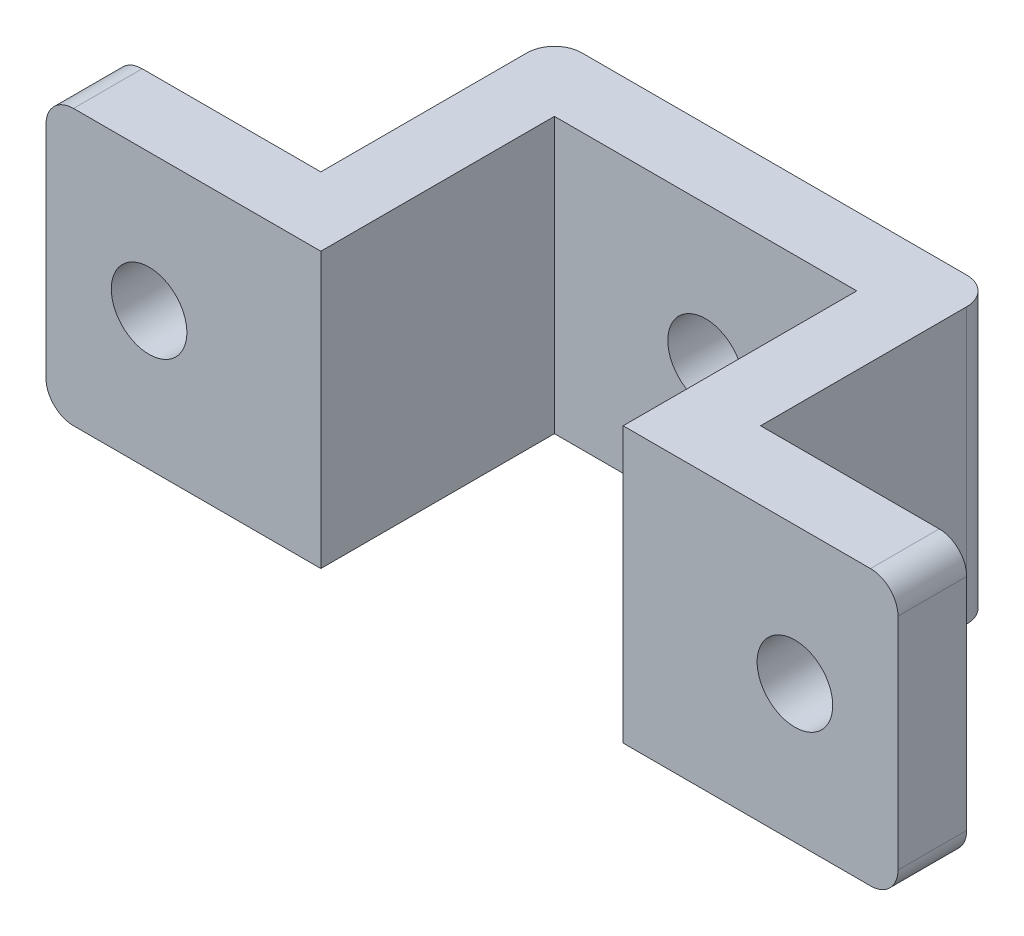
from build123d import *

# Parameters (mm, degrees)
EXTRUDE_1_DEPTH     = 20
SKETCH_2_R          = 2.75
CUT_EXTRUDE_1_DEPTH = 36.800621783
SKETCH_3_W          = 5
SKETCH_3_H          = 20
EXTRUDE_2_DEPTH     = 15
SKETCH_4_R          = 2.75
CUT_EXTRUDE_2_DEPTH = 38.697928264
FILLET_1_R          = 2
EXTRUDE_START       = 3
SKETCH_5_R          = 6
SKETCH_5_R_2        = 2.75
EXTRUDE_4_DEPTH     = 3


with BuildPart() as part:
    # 草图1 → 凸台-拉伸1 (new body)
    with BuildSketch(Plane(origin=(0, 0, 0), x_dir=(1, 0, 0), z_dir=(0, 1, 0))):
        Polygon((-12.057971014, 6.222222222), (19.942028986, 6.222222222), (19.942028986, -15.777777778), (14.942028986, -15.777777778), (14.942028986, -10.777777778), (14.942028986, 1.222222222), (-7.057971014, 1.222222222), (-7.057971014, -10.777777778), (-7.057971014, -15.777777778), (-12.057971014, -15.777777778), align=None)
    extrude(amount=EXTRUDE_1_DEPTH)

    # 草图2 → 切除-拉伸1 (cut, through all)
    with BuildSketch(Plane(origin=(0, 0, -6.222222222), x_dir=(-1, 0, 0), z_dir=(0, 0, -1))):
        with Locations((-3.942028986, 10)):
            Circle(SKETCH_2_R)
    extrude(amount=-CUT_EXTRUDE_1_DEPTH, mode=Mode.SUBTRACT)

    # 草图3 → 凸台-拉伸2 (add)
    with BuildSketch(Plane.ZY.offset(12.057971014)):
        with Locations((13.277777778, 10)):
            Rectangle(SKETCH_3_W, SKETCH_3_H)
    extrude_2 = extrude(amount=EXTRUDE_2_DEPTH)

    # 草图4 → 切除-拉伸2 (cut, through all)
    with BuildSketch(Plane(origin=(0, 0, 10.777777778), x_dir=(-1, 0, 0), z_dir=(0, 0, -1))):
        with Locations((19.557971014, 10)):
            Circle(SKETCH_4_R)
    cut_extrude_2 = extrude(amount=-CUT_EXTRUDE_2_DEPTH, mode=Mode.SUBTRACT)

    # 镜向5: 凸台-拉伸2, 切除-拉伸2 across plane
    add(extrude_2.mirror(Plane.ZY.offset(-3.942028986)))
    add(cut_extrude_2.mirror(Plane.ZY.offset(-3.942028986)), mode=Mode.SUBTRACT)

    # 圆角1
    fillet_1_edges = [part.edges().sort_by_distance(p)[0] for p in [
        (-12.057971014, 10, -6.222222222),
        (19.942028986, 10, -6.222222222),
        (-27.057971014, 0, 13.277777778),
        (-27.057971014, 20, 13.277777778),
        (34.942028986, 0, 13.277777778),
        (34.942028986, 20, 13.277777778),
    ]]
    fillet(fillet_1_edges, radius=FILLET_1_R)

    # 草图5 → 凸台-拉伸4 (add)
    with BuildSketch(Plane(origin=(0, 0, -6.222222222), x_dir=(-1, 0, 0), z_dir=(0, 0, -1)).offset(EXTRUDE_START)):
        with Locations(Location((-3.942028986, 10, 0), (0, 0, 180))):
            Circle(SKETCH_5_R)
        with Locations((-3.942028986, 10)):
            Circle(SKETCH_5_R_2, mode=Mode.SUBTRACT)
    extrude(amount=-EXTRUDE_4_DEPTH)


solid = part.part
